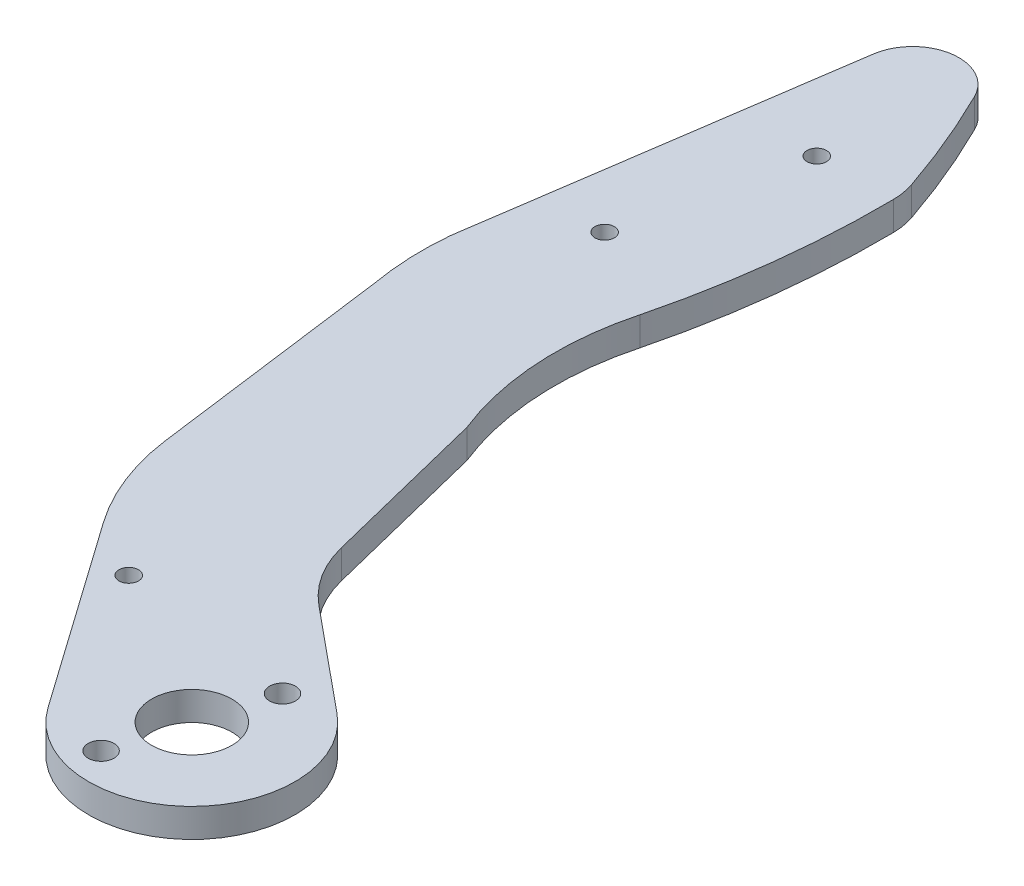
from build123d import *

# Parameters (mm, degrees)
SKETCH1_R                = 7
SKETCH1_R_2              = 1.7
BOSS_EXTRUDE2_DEPTH      = 5
CUT_EXTRUDE1_REACH       = 176.989
SKETCH3_R                = 1.7
M4_CLEARANCE_HOLE1_D     = 4.5
M4_CLEARANCE_HOLE1_DEPTH = 10.1
M4_CLEARANCE_HOLE1_TIP   = 1.351936393


with BuildPart() as part:
    # Sketch1 → Boss-Extrude2 (new body)
    with BuildSketch(Plane(origin=(0, 0, 0), x_dir=(1, 0, 0), z_dir=(0, 1, 0))):
        with BuildLine():
            Line((11.446477506, 13.891657666), (-6.606953629, 28.767362089))
            ThreePointArc((-6.606953629, 28.767362089), (-10.806918693, 33.53614027), (-13.298943796, 39.38171661))
            Line((-13.298943796, 39.38171661), (-20.530174792, 68.49716437))
            ThreePointArc((-20.530174792, 68.49716437), (-24.08112857, 84.393152776), (-22.456551163, 100.599709115))
            ThreePointArc((-22.456551163, 100.599709115), (-18.824269383, 120.221092129), (-17.76802696, 140.147870449))
            ThreePointArc((-17.76802696, 140.147870449), (-17.943181625, 142.067888002), (-18.417828761, 143.936539027))
            ThreePointArc((-18.417828761, 143.936539027), (-22.023480215, 153.489775682), (-26.256294904, 162.782156045))
            ThreePointArc((-26.256294904, 162.782156045), (-34.757388509, 167.168565439), (-41.482617684, 160.365590178))
            Line((-41.482617684, 160.365590178), (-50.932711484, 96.056215067))
            ThreePointArc((-50.932711484, 96.056215067), (-51.118515181, 89.191813761), (-50.383474997, 82.364351257))
            Line((-50.383474997, 82.364351257), (-44.819294227, 40.249739786))
            ThreePointArc((-44.819294227, 40.249739786), (-42.41581584, 30.91866257), (-37.850662253, 22.433081678))
            Line((-37.850662253, 22.433081678), (-14.709041721, -10.375167067))
            ThreePointArc((-14.709041721, -10.375167067), (12.242580486, -13.195424322), (11.446477506, 13.891657666))
        make_face()
        with Locations(Location((0, 0, 0), (0, 0, 270))):
            Circle(SKETCH1_R, mode=Mode.SUBTRACT)
        with Locations(Location((-27.673284612, 16.679008328, 0), (0, 0, 270))):
            Circle(SKETCH1_R_2, mode=Mode.SUBTRACT)
    extrude(amount=BOSS_EXTRUDE2_DEPTH)

    # Sketch3 → Cut-Extrude1 (cut, up to next)
    with BuildSketch(Plane(origin=(0, 5, 0), x_dir=(1, 0, 0), z_dir=(0, 1, 0)), mode=Mode.PRIVATE) as cut_extrude1_sk1:
        with Locations(Location((-31, 140, 0), (0, 0, 270))):
            Circle(SKETCH3_R)
    cut_extrude1_tool1 = extrude(cut_extrude1_sk1.sketch, amount=-CUT_EXTRUDE1_REACH, mode=Mode.PRIVATE) & part.part
    # Sketch3 → Cut-Extrude1 (cut, up to next)
    with BuildSketch(Plane(origin=(0, 5, 0), x_dir=(1, 0, 0), z_dir=(0, 1, 0)), mode=Mode.PRIVATE) as cut_extrude1_sk2:
        with Locations(Location((-38, 110, 0), (0, 0, 270))):
            Circle(SKETCH3_R)
    cut_extrude1_tool2 = extrude(cut_extrude1_sk2.sketch, amount=-CUT_EXTRUDE1_REACH, mode=Mode.PRIVATE) & part.part
    add(cut_extrude1_tool1.solids().sort_by_distance((-31, 5, -140))[0], mode=Mode.SUBTRACT)
    add(cut_extrude1_tool2.solids().sort_by_distance((-38, 5, -110))[0], mode=Mode.SUBTRACT)

    # M4 Clearance Hole1
    with Locations(Plane(origin=(-3.585359684, 5, 12.235509631), x_dir=(0, 0, 1), z_dir=(0, 1, 0))):
        with Locations((0, 0), (-24.471019262, 7.170719368)):
            Hole(M4_CLEARANCE_HOLE1_D / 2, depth=M4_CLEARANCE_HOLE1_DEPTH)
            with Locations((0, 0, -(M4_CLEARANCE_HOLE1_DEPTH + M4_CLEARANCE_HOLE1_TIP / 2))):  # 118° drill point
                Cone(0, M4_CLEARANCE_HOLE1_D / 2, M4_CLEARANCE_HOLE1_TIP, mode=Mode.SUBTRACT)


solid = part.part
